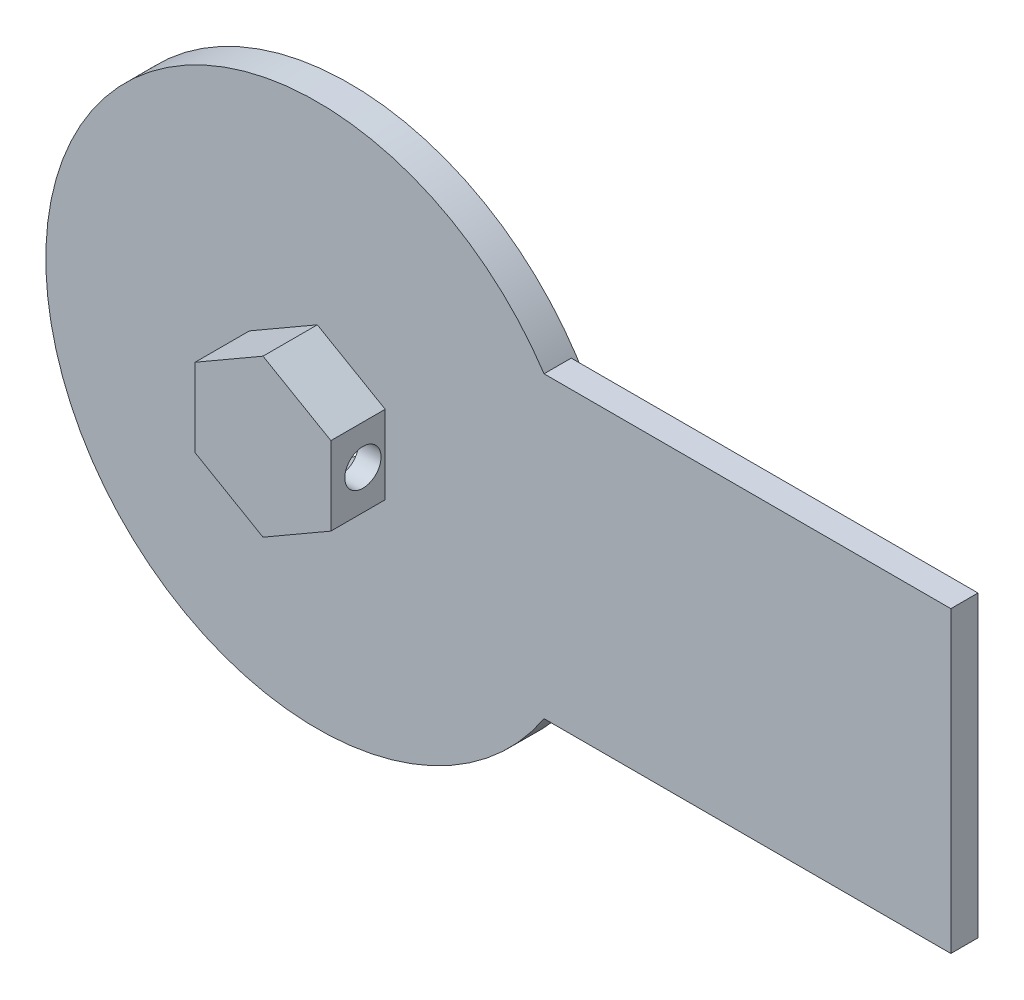
from build123d import *

# Parameters (mm, degrees)
SKETCH1_R           = 30
BOSS_EXTRUDE1_DEPTH = 3.54
BOSS_EXTRUDE4_START = -3
BOSS_EXTRUDE4_DEPTH = 3
CUT_EXTRUDE3_DEPTH  = 6
BOSS_EXTRUDE5_DEPTH = 6
BOSS_EXTRUDE6_DEPTH = 0.4
CUT_EXTRUDE4_REACH  = 71.98
SKETCH12_R          = 2


with BuildPart() as part:
    # Sketch1 → Boss-Extrude1 (new body)
    with BuildSketch(Plane.XY):
        Circle(SKETCH1_R)
    extrude(amount=BOSS_EXTRUDE1_DEPTH)

    # Sketch4 → Boss-Extrude4 (add)
    with BuildSketch(Plane.XY.offset(3.54).offset(BOSS_EXTRUDE4_START)):
        with BuildLine():
            Line((25.054939633, 16.5), (70, 16.5))
            Line((70, 16.5), (70, -16.5))
            Line((70, -16.5), (25.054939633, -16.5))
            ThreePointArc((25.054939633, -16.5), (30, 0), (25.054939633, 16.5))
        make_face()
    extrude(amount=BOSS_EXTRUDE4_DEPTH)

    # Sketch9 → Cut-Extrude3 (cut)
    with BuildSketch(Plane(origin=(0, 0, 0), x_dir=(-1, 0, 0), z_dir=(0, 0, -1))):
        Polygon((0, 5.773502692), (-5, 2.886751346), (-5, -2.886751346), (0, -5.773502692), (5, -2.886751346), (5, 2.886751346), align=None)
    extrude(amount=-CUT_EXTRUDE3_DEPTH, mode=Mode.SUBTRACT)

    # Sketch10 → Boss-Extrude5 (add)
    with BuildSketch(Plane.XY.offset(3.54)):
        Polygon((0, 8.660254038), (-7.5, 4.330127019), (-7.5, -4.330127019), (0, -8.660254038), (7.5, -4.330127019), (7.5, 4.330127019), align=None)
        Polygon((0, 5.773502692), (-5, 2.886751346), (-5, -2.886751346), (0, -5.773502692), (5, -2.886751346), (5, 2.886751346), align=None, mode=Mode.SUBTRACT)
    extrude(amount=BOSS_EXTRUDE5_DEPTH)

    # Sketch11 → Boss-Extrude6 (add)
    with BuildSketch(Plane.XY.offset(9.54)):
        Polygon((0, 5.773502692), (-5, 2.886751346), (-5, -2.886751346), (0, -5.773502692), (5, -2.886751346), (5, 2.886751346), align=None)
    extrude(amount=-BOSS_EXTRUDE6_DEPTH)

    # Sketch12 → Cut-Extrude4 (cut, up to next)
    with BuildSketch(Plane(origin=(7.5, 0, 0), x_dir=(0, 0, -1), z_dir=(1, 0, 0)), mode=Mode.PRIVATE) as cut_extrude4_sk1:
        with Locations((-6, 0)):
            Circle(SKETCH12_R)
    cut_extrude4_tool1 = extrude(cut_extrude4_sk1.sketch, amount=-CUT_EXTRUDE4_REACH, mode=Mode.PRIVATE) & part.part
    add(cut_extrude4_tool1.solids().sort_by_distance((7.5, 0, 6))[0], mode=Mode.SUBTRACT)


solid = part.part
